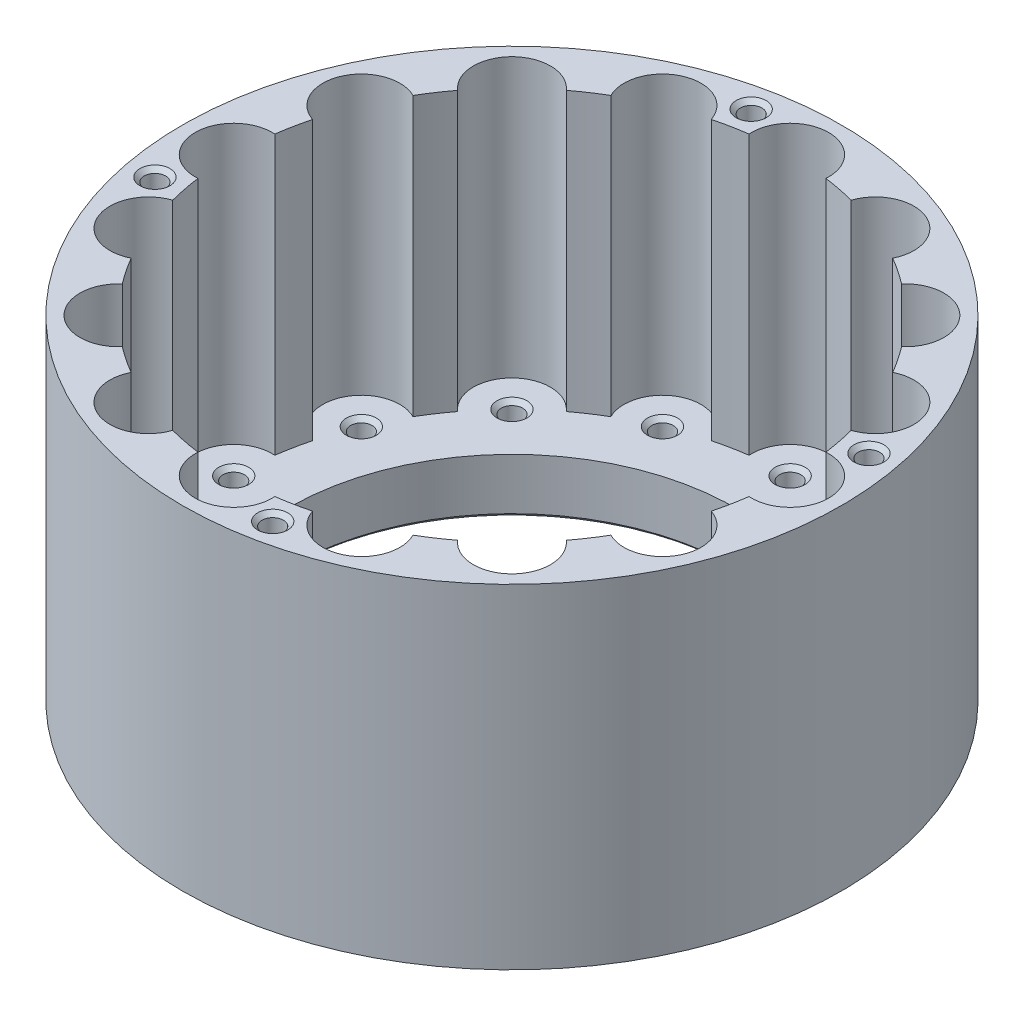
from build123d import *

# Parameters (mm, degrees)
SKIZZE1_R                                  = 38.5
AUFSATZ_LINEAR_AUSTRAGEN1_DEPTH            = 39
SCHNITT_LINEAR_AUSTRAGEN1_DEPTH            = 32.5
SKIZZE3_R                                  = 26.075
SCHNITT_LINEAR_AUSTRAGEN2_DEPTH            = 67.973875504
F_2_5_2_5_DURCHMESSER_BOHRUNG1_D           = 2.5
F_2_5_2_5_DURCHMESSER_BOHRUNG1_CSINK_D     = 3.5
F_2_5_2_5_DURCHMESSER_BOHRUNG1_CSINK_ANGLE = 90
F_2_5_2_5_DURCHMESSER_BOHRUNG2_D           = 2.5
F_2_5_2_5_DURCHMESSER_BOHRUNG2_DEPTH       = 15
F_2_5_2_5_DURCHMESSER_BOHRUNG2_CSINK_D     = 3.5
F_2_5_2_5_DURCHMESSER_BOHRUNG2_CSINK_ANGLE = 90
F_2_5_2_5_DURCHMESSER_BOHRUNG2_TIP         = 0.751075774
FASE1_SIZE                                 = 0.5


with BuildPart() as part:
    # Skizze1 → Aufsatz-Linear austragen1 (new body)
    with BuildSketch(Plane(origin=(0, 0, 0), x_dir=(1, 0, 0), z_dir=(0, 1, 0))):
        with Locations(Location((0, 0, 0), (0, 0, 270))):
            Circle(SKIZZE1_R)
    extrude(amount=AUFSATZ_LINEAR_AUSTRAGEN1_DEPTH)

    # Skizze2 → Schnitt-Linear austragen1 (cut)
    with BuildSketch(Plane(origin=(0, 39, 0), x_dir=(1, 0, 0), z_dir=(0, 1, 0))):
        with BuildLine():
            ThreePointArc((4.489203024, 32.188461538), (0, 37), (-4.489203024, 32.188461538))
            ThreePointArc((-4.489203024, 32.188461538), (-6.340435466, 31.875521613), (-8.170508153, 31.45620442))
            ThreePointArc((-8.170508153, 31.45620442), (-14.159286998, 34.183542703), (-16.465473735, 28.020317177))
            ThreePointArc((-16.465473735, 28.020317177), (-18.056032573, 27.0227624), (-19.58633353, 25.93502533))
            ThreePointArc((-19.58633353, 25.93502533), (-26.162950904, 26.162950904), (-25.93502533, 19.58633353))
            ThreePointArc((-25.93502533, 19.58633353), (-27.0227624, 18.056032573), (-28.020317177, 16.465473735))
            ThreePointArc((-28.020317177, 16.465473735), (-34.183542703, 14.159286998), (-31.45620442, 8.170508153))
            ThreePointArc((-31.45620442, 8.170508153), (-31.875521613, 6.340435466), (-32.188461538, 4.489203024))
            ThreePointArc((-32.188461538, 4.489203024), (-37, 0), (-32.188461538, -4.489203024))
            ThreePointArc((-32.188461538, -4.489203024), (-31.875521613, -6.340435466), (-31.45620442, -8.170508153))
            ThreePointArc((-31.45620442, -8.170508153), (-34.183542703, -14.159286998), (-28.020317177, -16.465473735))
            ThreePointArc((-28.020317177, -16.465473735), (-27.0227624, -18.056032573), (-25.93502533, -19.58633353))
            ThreePointArc((-25.93502533, -19.58633353), (-26.162950904, -26.162950904), (-19.58633353, -25.93502533))
            ThreePointArc((-19.58633353, -25.93502533), (-18.056032573, -27.0227624), (-16.465473735, -28.020317177))
            ThreePointArc((-16.465473735, -28.020317177), (-14.159286998, -34.183542703), (-8.170508153, -31.45620442))
            ThreePointArc((-8.170508153, -31.45620442), (-6.340435466, -31.875521613), (-4.489203024, -32.188461538))
            ThreePointArc((-4.489203024, -32.188461538), (0, -37), (4.489203024, -32.188461538))
            ThreePointArc((4.489203024, -32.188461538), (6.340435466, -31.875521613), (8.170508153, -31.45620442))
            ThreePointArc((8.170508153, -31.45620442), (14.159286998, -34.183542703), (16.465473735, -28.020317177))
            ThreePointArc((16.465473735, -28.020317177), (18.056032573, -27.0227624), (19.58633353, -25.93502533))
            ThreePointArc((19.58633353, -25.93502533), (26.162950904, -26.162950904), (25.93502533, -19.58633353))
            ThreePointArc((25.93502533, -19.58633353), (27.0227624, -18.056032573), (28.020317177, -16.465473735))
            ThreePointArc((28.020317177, -16.465473735), (34.183542703, -14.159286998), (31.45620442, -8.170508153))
            ThreePointArc((31.45620442, -8.170508153), (31.875521613, -6.340435466), (32.188461538, -4.489203024))
            ThreePointArc((32.188461538, -4.489203024), (37, 0), (32.188461538, 4.489203024))
            ThreePointArc((32.188461538, 4.489203024), (31.875521613, 6.340435466), (31.45620442, 8.170508153))
            ThreePointArc((31.45620442, 8.170508153), (34.183542703, 14.159286998), (28.020317177, 16.465473735))
            ThreePointArc((28.020317177, 16.465473735), (27.0227624, 18.056032573), (25.93502533, 19.58633353))
            ThreePointArc((25.93502533, 19.58633353), (26.162950904, 26.162950904), (19.58633353, 25.93502533))
            ThreePointArc((19.58633353, 25.93502533), (18.056032573, 27.0227624), (16.465473735, 28.020317177))
            ThreePointArc((16.465473735, 28.020317177), (14.159286998, 34.183542703), (8.170508153, 31.45620442))
            ThreePointArc((8.170508153, 31.45620442), (6.340435466, 31.875521613), (4.489203024, 32.188461538))
        make_face()
    extrude(amount=-SCHNITT_LINEAR_AUSTRAGEN1_DEPTH, mode=Mode.SUBTRACT)

    # Skizze3 → Schnitt-Linear austragen2 (cut, through all)
    with BuildSketch(Plane.XZ):
        with Locations(Location((0, 0, 0), (0, 0, 270))):
            Circle(SKIZZE3_R)
    extrude(amount=-SCHNITT_LINEAR_AUSTRAGEN2_DEPTH, mode=Mode.SUBTRACT)

    # Ø2.5 (2.5) Durchmesser Bohrung1 (through all)
    with Locations(Plane(origin=(0, 6.5, 0), x_dir=(1, 0, 0), z_dir=(0, 1, 0))):
        with Locations((0, 32.5), (12.437211552, 30.026084807), (22.980970389, 22.980970389), (30.026084807, 12.437211552), (32.5, 0), (30.026084807, -12.437211552), (22.980970389, -22.980970389), (12.437211552, -30.026084807), (0, -32.5), (-12.437211552, -30.026084807), (-22.980970389, -22.980970389), (-30.026084807, -12.437211552), (-32.5, 0), (-30.026084807, 12.437211552), (-22.980970389, 22.980970389), (-12.437211552, 30.026084807)):
            CounterSinkHole(F_2_5_2_5_DURCHMESSER_BOHRUNG1_D / 2, F_2_5_2_5_DURCHMESSER_BOHRUNG1_CSINK_D / 2, counter_sink_angle=F_2_5_2_5_DURCHMESSER_BOHRUNG1_CSINK_ANGLE)

    # Ø2.5 (2.5) Durchmesser Bohrung2
    with Locations(Plane(origin=(0, 39, 0), x_dir=(1, 0, 0), z_dir=(0, 1, 0))):
        with Locations((-34.827105043, -6.879153607), (-6.879153607, 34.827105043), (34.827105043, 6.879153607), (6.879153607, -34.827105043)):
            CounterSinkHole(F_2_5_2_5_DURCHMESSER_BOHRUNG2_D / 2, F_2_5_2_5_DURCHMESSER_BOHRUNG2_CSINK_D / 2, depth=F_2_5_2_5_DURCHMESSER_BOHRUNG2_DEPTH, counter_sink_angle=F_2_5_2_5_DURCHMESSER_BOHRUNG2_CSINK_ANGLE)
            with Locations((0, 0, -(F_2_5_2_5_DURCHMESSER_BOHRUNG2_DEPTH + F_2_5_2_5_DURCHMESSER_BOHRUNG2_TIP / 2))):  # 118° drill point
                Cone(0, F_2_5_2_5_DURCHMESSER_BOHRUNG2_D / 2, F_2_5_2_5_DURCHMESSER_BOHRUNG2_TIP, mode=Mode.SUBTRACT)

    # Fase1
    fase1_edges = [part.edges().sort_by_distance(p)[0] for p in [
        (0, 0, 26.075),
    ]]
    chamfer(fase1_edges, length=FASE1_SIZE)


solid = part.part
